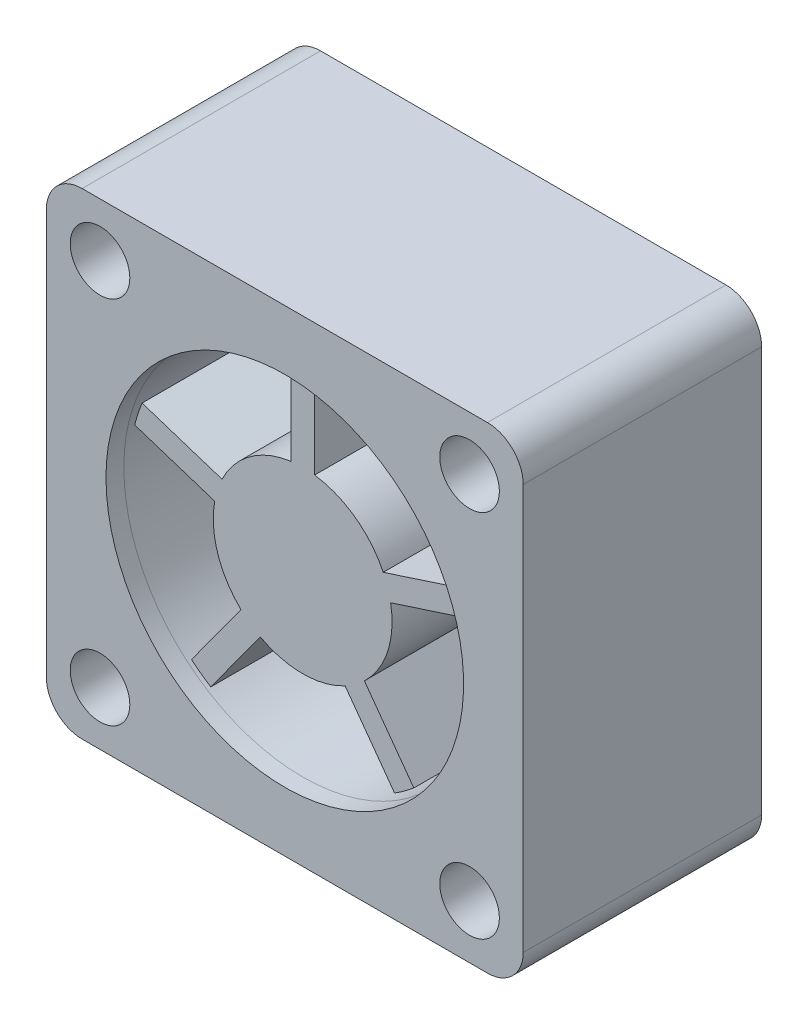
from build123d import *
from build123d.topology import SkipClean

# Parameters (mm, degrees)
SKETCH2_W           = 40
SKETCH2_H           = 40
BOSS_EXTRUDE1_DEPTH = 20
SKETCH3_R           = 2.5
CUT_EXTRUDE1_DEPTH  = 20
FILLET1_R           = 3
CUT_EXTRUDE4_DEPTH  = 35.641016151
CUT_EXTRUDE5_START  = -1.5
SKETCH5_R           = 15
CUT_EXTRUDE5_DEPTH  = 1.5
SKETCH7_R           = 15.025
SKETCH7_R_2         = 14.525398349
CUT_EXTRUDE12_DEPTH = 26


with BuildPart() as part:
    # Sketch2 → Boss-Extrude1 (new body)
    with BuildSketch(Plane.XY):
        Rectangle(SKETCH2_W, SKETCH2_H)
    extrude(amount=BOSS_EXTRUDE1_DEPTH)

    # Sketch3 → Cut-Extrude1 (cut)
    with BuildSketch(Plane.XY.offset(20)):
        with Locations((-15.5, 15.5)):
            Circle(SKETCH3_R)
        with Locations((15.5, 15.5)):
            Circle(SKETCH3_R)
        with Locations((15.5, -15.5)):
            Circle(SKETCH3_R)
        with Locations((-15.5, -15.5)):
            Circle(SKETCH3_R)
    extrude(amount=-CUT_EXTRUDE1_DEPTH, mode=Mode.SUBTRACT)

    # Fillet1
    fillet1_edges = [part.edges().sort_by_distance(p)[0] for p in [
        (20, -20, 10),
        (-20, -20, 10),
        (-20, 20, 10),
        (20, 20, 10),
    ]]
    fillet(fillet1_edges, radius=FILLET1_R)

    # Sketch4 → Cut-Extrude4 (cut, through all)
    with BuildSketch(Plane(origin=(0, 0, 0), x_dir=(-1, 0, 0), z_dir=(0, 0, -1))):
        with BuildLine():
            Line((13.925093563, 5.575999395), (6.760218783, 3.247990458))
            ThreePointArc((6.760218783, 3.247990458), (4.408389392, 6.067627458), (1, 7.433034374))
            Line((1, 7.433034374), (1, 14.966629547))
            ThreePointArc((1, 14.966629547), (8.816778784, 12.135254916), (13.925093563, 5.575999395))
        make_face()
        with BuildLine():
            Line((-1, 14.966629547), (-1, 7.433034374))
            ThreePointArc((-1, 7.433034374), (-4.408389392, 6.067627458), (-6.760218783, 3.247990458))
            Line((-6.760218783, 3.247990458), (-13.925093563, 5.575999395))
            ThreePointArc((-13.925093563, 5.575999395), (-8.816778784, 12.135254916), (-1, 14.966629547))
        make_face()
        with BuildLine():
            Line((14.543127552, 3.673886362), (7.378252771, 1.345877425))
            ThreePointArc((7.378252771, 1.345877425), (7.132923872, -2.317627458), (5.178044979, -5.425665876))
            Line((5.178044979, -5.425665876), (9.606181119, -11.5204724))
            ThreePointArc((9.606181119, -11.5204724), (14.265847744, -4.635254916), (14.543127552, 3.673886362))
        make_face()
        with BuildLine():
            Line((7.98814713, -12.696042904), (3.56001099, -6.60123638))
            ThreePointArc((3.56001099, -6.60123638), (0, -7.5), (-3.56001099, -6.60123638))
            Line((-3.56001099, -6.60123638), (-7.98814713, -12.696042904))
            ThreePointArc((-7.98814713, -12.696042904), (0, -15), (7.98814713, -12.696042904))
        make_face()
        with BuildLine():
            Line((-9.606181119, -11.5204724), (-5.178044979, -5.425665876))
            ThreePointArc((-5.178044979, -5.425665876), (-7.132923872, -2.317627458), (-7.378252771, 1.345877425))
            Line((-7.378252771, 1.345877425), (-14.543127552, 3.673886362))
            ThreePointArc((-14.543127552, 3.673886362), (-14.265847744, -4.635254916), (-9.606181119, -11.5204724))
        make_face()
    extrude(amount=-CUT_EXTRUDE4_DEPTH, mode=Mode.SUBTRACT)

    # Sketch5 → Cut-Extrude5 (cut)
    with BuildSketch(Plane.XY.offset(20).offset(CUT_EXTRUDE5_START)):
        with Locations(Location((0, 0, 0), (0, 0, 180))):
            Circle(SKETCH5_R)
    extrude(amount=CUT_EXTRUDE5_DEPTH, mode=Mode.SUBTRACT)

    # Sketch7 → Cut-Extrude12 (cut)
    with SkipClean():  # the faces are left unmerged after this step: merging them gives an invalid solid
        with BuildSketch(Plane.XY.offset(18.5)):
            Circle(SKETCH7_R)
            Circle(SKETCH7_R_2, mode=Mode.SUBTRACT)
        extrude(amount=-CUT_EXTRUDE12_DEPTH, mode=Mode.SUBTRACT)


with BuildPart() as cut_extrude12_piece_1:
    # of the separate pieces the step leaves, piece 1, a body of its own (cut_extrude12_pieces)
    add(part.part.solids().sort_by_distance((-17, -20, 0))[0])


with BuildPart() as cut_extrude12_piece_2:
    # of the separate pieces the step leaves, piece 2, a body of its own (cut_extrude12_pieces)
    add(part.part.solids().sort_by_distance((3.56001099, -6.60123638, 0))[0])


solid = Compound([cut_extrude12_piece_1.part, cut_extrude12_piece_2.part])
